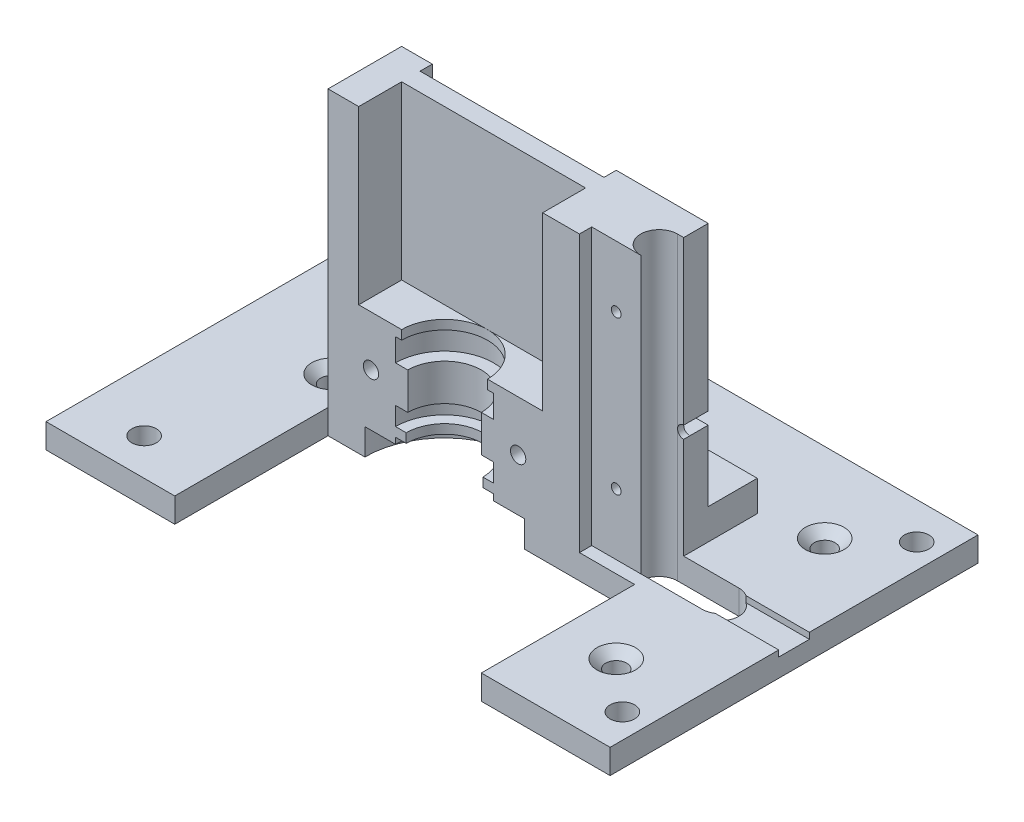
from build123d import *

# Parameters (mm, degrees)
BOSS_EXTRUDE1_DEPTH                          = 4
SKETCH2_W                                    = 50
SKETCH2_H                                    = 20
BOSS_EXTRUDE2_DEPTH                          = 5
SKETCH3_W                                    = 50
SKETCH3_H                                    = 12
BOSS_EXTRUDE3_DEPTH                          = 40
CUT_EXTRUDE1_DEPTH                           = 2
SKETCH5_W                                    = 30
SKETCH5_H                                    = 28
CUT_EXTRUDE2_DEPTH                           = 7
CUT_EXTRUDE3_DEPTH                           = 55
SKETCH8_W                                    = 9
SKETCH8_H                                    = 45
CUT_EXTRUDE4_DEPTH                           = 2
SKETCH9_W                                    = 50
SKETCH9_H                                    = 2
CUT_EXTRUDE5_DEPTH                           = 3
SKETCH10_R                                   = 1
CUT_EXTRUDE6_DEPTH                           = 2
SKETCH11_W                                   = 15
SKETCH11_H                                   = 5
CUT_EXTRUDE7_DEPTH                           = 1
SKETCH12_W                                   = 28.5
SKETCH12_H                                   = 8.5
BOSS_EXTRUDE4_DEPTH                          = 2
SKETCH13_W                                   = 27
SKETCH13_H                                   = 8
CUT_EXTRUDE8_DEPTH                           = 15
BOSS_EXTRUDE5_DEPTH                          = 27
SKETCH31_W                                   = 27
SKETCH31_H                                   = 0.75
CUT_EXTRUDE26_DEPTH                          = 4
M3_TAPPED_HOLE1_AT_2_COUNT                   = 2
M3_TAPPED_HOLE1_AT_2_PITCH                   = 24
SKETCH25_W                                   = 0.8
SKETCH25_H                                   = 33
M2_TAPPED_HOLE1_AT_2_COUNT                   = 2
M2_TAPPED_HOLE1_AT_2_PITCH                   = 25
SKETCH26_R                                   = 2
CUT_EXTRUDE25_DEPTH                          = 5
LPATTERN2_COUNT                              = 2
LPATTERN2_PITCH                              = 78
LPATTERN2_COUNT_DIR2                         = 2
LPATTERN2_PITCH_DIR2                         = 48
CSK_FOR_M3_COUNTERSUNK_FLAT_HEAD_SCR_2_COUNT = 2
CSK_FOR_M3_COUNTERSUNK_FLAT_HEAD_SCR_2_PITCH = 65.736215285
CSK_FOR_M3_COUNTERSUNK_FLAT_HEAD_SCR_3_COUNT = 2
CSK_FOR_M3_COUNTERSUNK_FLAT_HEAD_SCR_3_PITCH = 65.736215285
LPATTERN3_COUNT                              = 2
LPATTERN3_PITCH                              = 35
LPATTERN3_COUNT_DIR2                         = 2
LPATTERN3_PITCH_DIR2                         = 35
FILLET1_R                                    = 2
SKETCH32_R                                   = 13
CUT_EXTRUDE27_DEPTH                          = 4.3


with BuildPart() as part:
    # Sketch1 → Boss-Extrude1 (new body)
    with BuildSketch(Plane(origin=(0, 0, 0), x_dir=(1, 0, 0), z_dir=(0, 1, 0))):
        Polygon((25, -30), (46, -30), (46, 30), (-9.5, 30), (-9.5, 25), (-25, 25), (-25, 30), (-46, 30), (-46, -30), (-25, -30), (-25, -5), (25, -5), align=None)
    extrude(amount=BOSS_EXTRUDE1_DEPTH)

    # Sketch2 → Boss-Extrude2 (add)
    with BuildSketch(Plane(origin=(0, 4, 0), x_dir=(1, 0, 0), z_dir=(0, 1, 0))):
        with Locations((0, 5)):
            Rectangle(SKETCH2_W, SKETCH2_H)
    extrude(amount=BOSS_EXTRUDE2_DEPTH)

    # Sketch3 → Boss-Extrude3 (add)
    with BuildSketch(Plane(origin=(0, 9, 0), x_dir=(1, 0, 0), z_dir=(0, 1, 0))):
        with Locations((0, 1)):
            Rectangle(SKETCH3_W, SKETCH3_H)
    extrude(amount=BOSS_EXTRUDE3_DEPTH)

    # Sketch4 → Cut-Extrude1 (cut)
    with BuildSketch(Plane(origin=(0, 0, -7), x_dir=(-1, 0, 0), z_dir=(0, 0, -1))):
        Polygon((-10, 49), (20, 49), (20, 44), (25, 44), (25, 14), (20, 14), (20, 9), (-10, 9), (-10, 14), (-15, 14), (-15, 44), (-10, 44), align=None)
    extrude(amount=-CUT_EXTRUDE1_DEPTH, mode=Mode.SUBTRACT)

    # Sketch5 → Cut-Extrude2 (cut)
    with BuildSketch(Plane.XY.offset(5)):
        with Locations((-5, 35)):
            Rectangle(SKETCH5_W, SKETCH5_H)
    extrude(amount=-CUT_EXTRUDE2_DEPTH, mode=Mode.SUBTRACT)

    # Sketch6 → Cut-Revolve1 (revolve, cut)
    with BuildSketch(Plane.ZY.offset(6)):
        Polygon((5, 0), (5, 21), (-2, 21), (-2, 19.5), (-3, 19.5), (-3, 15.8), (-1, 15.8), (-1, 9.8), (-3, 9.8), (-3, 6.8), (-1.25, 6.8), (-1.25, 5.3), (-3, 5.3), (-3, 4.3), (-8, 4.3), (-8, 0), align=None)
    revolve(axis=Axis((-6, 0, 5), (0, 1, 0)), mode=Mode.SUBTRACT)

    # Sketch7 → Cut-Extrude3 (cut)
    with BuildSketch(Plane.XZ):
        with BuildLine():
            Line((34, -3), (24, -3))
            ThreePointArc((24, -3), (21, 0), (24, 3))
            Line((24, 3), (34, 3))
            ThreePointArc((34, 3), (37, 0), (34, -3))
        make_face()
    extrude(amount=-CUT_EXTRUDE3_DEPTH, mode=Mode.SUBTRACT)

    # Sketch8 → Cut-Extrude4 (cut)
    with BuildSketch(Plane.XY.offset(5)):
        with Locations((20.5, 26.5)):
            Rectangle(SKETCH8_W, SKETCH8_H)
    extrude(amount=-CUT_EXTRUDE4_DEPTH, mode=Mode.SUBTRACT)

    # Sketch9 → Cut-Extrude5 (cut)
    with BuildSketch(Plane(origin=(0, 0, -7), x_dir=(-1, 0, 0), z_dir=(0, 0, -1))):
        with Locations((0, 21.5)):
            Rectangle(SKETCH9_W, SKETCH9_H)
    extrude(amount=-CUT_EXTRUDE5_DEPTH, mode=Mode.SUBTRACT)

    # Sketch10 → Cut-Extrude6 (cut)
    with BuildSketch(Plane(origin=(0, 0, -4), x_dir=(-1, 0, 0), z_dir=(0, 0, -1))):
        with Locations((-25, 21.5)):
            Circle(SKETCH10_R)
    extrude(amount=-CUT_EXTRUDE6_DEPTH, mode=Mode.SUBTRACT)

    # Sketch11 → Cut-Extrude7 (cut)
    with BuildSketch(Plane(origin=(0, 4, 0), x_dir=(1, 0, 0), z_dir=(0, 1, 0))):
        with Locations((38.5, 0)):
            Rectangle(SKETCH11_W, SKETCH11_H)
    extrude(amount=-CUT_EXTRUDE7_DEPTH, mode=Mode.SUBTRACT)

    # Sketch12 → Boss-Extrude4 (add)
    with BuildSketch(Plane(origin=(0, 9, 0), x_dir=(1, 0, 0), z_dir=(0, 1, 0))):
        with Locations((-5, 10)):
            Rectangle(SKETCH12_W, SKETCH12_H)
    extrude(amount=BOSS_EXTRUDE4_DEPTH)

    # Sketch13 → Cut-Extrude8 (cut)
    with BuildSketch(Plane(origin=(0, 11, 0), x_dir=(1, 0, 0), z_dir=(0, 1, 0))):
        with Locations((-5.25, 9.75)):
            Rectangle(SKETCH13_W, SKETCH13_H)
    extrude(amount=-CUT_EXTRUDE8_DEPTH, mode=Mode.SUBTRACT)

    # Sketch18 → Boss-Extrude5 (add)
    with BuildSketch(Plane.ZY.offset(-8.25)):
        Polygon((-7, 4), (-7, 0), (-5.75, 0), (-5.75, 9), (-7.75, 5), (-7.75, 4), align=None)
    extrude(amount=BOSS_EXTRUDE5_DEPTH)

    # Sketch31 → Cut-Extrude26 (cut)
    with BuildSketch(Plane.XZ):
        with Locations((-5.25, -14.125)):
            Rectangle(SKETCH31_W, SKETCH31_H)
    extrude(amount=-CUT_EXTRUDE26_DEPTH, mode=Mode.SUBTRACT)

    # Sketch21 → Revolve2 (revolve)
    with BuildSketch(Plane.ZY.offset(-3)):
        with BuildLine():
            Line((-14.5, 3), (-14.5, 2))
            Line((-14.5, 2), (-13.5, 2))
            ThreePointArc((-13.5, 2), (-13.792893219, 2.707106781), (-14.5, 3))
        make_face()
        with BuildLine():
            Line((-7, 3), (-7, 2))
            Line((-7, 2), (-8, 2))
            ThreePointArc((-8, 2), (-7.707106781, 2.707106781), (-7, 3))
        make_face()
    revolve(axis=Axis((3, 2, -14.5), (0, 0, 1)))

    # Sketch23 → M3 Tapped Hole1 (revolve, cut)
    with BuildSketch(Plane(origin=(-18, 12.8, 5), x_dir=(0, -1, 0), z_dir=(1, 0, 0))):
        Polygon((0, 0), (0, 7.751075774), (1.25, 7), (1.25, 0), align=None)
    m3_tapped_hole1 = revolve(axis=Axis((-18, 12.8, 11.35), (0, 0, -1)), mode=Mode.SUBTRACT)

    # M3 Tapped Hole1 at 2: M3 Tapped Hole1 ×2
    with Locations(*[(i * M3_TAPPED_HOLE1_AT_2_PITCH, 0, 0) for i in range(1, M3_TAPPED_HOLE1_AT_2_COUNT)]):
        add(m3_tapped_hole1, mode=Mode.SUBTRACT)

    # Sketch25 → M2 Tapped Hole1 (revolve, cut)
    with BuildSketch(Plane(origin=(20, 39, 3), x_dir=(0, -1, 0), z_dir=(1, 0, 0))):
        with Locations((0.4, 16.5)):
            Rectangle(SKETCH25_W, SKETCH25_H)
    m2_tapped_hole1 = revolve(axis=Axis((20, 39, 9.35), (0, 0, -1)), mode=Mode.SUBTRACT)

    # M2 Tapped Hole1 at 2: M2 Tapped Hole1 ×2
    with Locations(*[(0, -i * M2_TAPPED_HOLE1_AT_2_PITCH, 0) for i in range(1, M2_TAPPED_HOLE1_AT_2_COUNT)]):
        add(m2_tapped_hole1, mode=Mode.SUBTRACT)

    # Sketch26 → Cut-Extrude25 (cut)
    with BuildSketch(Plane(origin=(0, 4, 0), x_dir=(1, 0, 0), z_dir=(0, 1, 0))):
        with Locations(Location((-36, 24, 0), (0, 0, 270))):
            Circle(SKETCH26_R)
    cut_extrude25 = extrude(amount=-CUT_EXTRUDE25_DEPTH, mode=Mode.SUBTRACT)

    # LPattern2: Cut-Extrude25 2 × 2
    with Locations(*[(i * LPATTERN2_PITCH, 0, j * LPATTERN2_PITCH_DIR2) for i in range(LPATTERN2_COUNT) for j in range(LPATTERN2_COUNT_DIR2) if (i, j) != (0, 0)]):
        add(cut_extrude25, mode=Mode.SUBTRACT)

    # Sketch28 → CSK for M3 Countersunk Flat Head Screw1 (revolve, cut)
    with BuildSketch(Plane(origin=(-29.5, 4, 0), x_dir=(0, 0, 1), z_dir=(1, 0, 0))):
        Polygon((0, 0), (0, 4), (1.7, 4), (1.7, 1.45), (3.15, 0), align=None)
    csk_for_m3_countersunk_flat_head_screw1 = revolve(axis=Axis((-29.5, 10.35, 0), (0, -1, 0)), mode=Mode.SUBTRACT)

    # CSK for M3 Countersunk Flat Head Scr 2: CSK for M3 Countersunk Flat Head Screw1 ×2
    with Locations(*[Vector(0.9659819891465423, 0, -0.25860935142505853) * (i * CSK_FOR_M3_COUNTERSUNK_FLAT_HEAD_SCR_2_PITCH) for i in range(1, CSK_FOR_M3_COUNTERSUNK_FLAT_HEAD_SCR_2_COUNT)]):
        add(csk_for_m3_countersunk_flat_head_screw1, mode=Mode.SUBTRACT)

    # CSK for M3 Countersunk Flat Head Scr 3: CSK for M3 Countersunk Flat Head Screw1 ×2
    with Locations(*[Vector(0.9659819891465423, 0, 0.25860935142505864) * (i * CSK_FOR_M3_COUNTERSUNK_FLAT_HEAD_SCR_3_PITCH) for i in range(1, CSK_FOR_M3_COUNTERSUNK_FLAT_HEAD_SCR_3_COUNT)]):
        add(csk_for_m3_countersunk_flat_head_screw1, mode=Mode.SUBTRACT)

    # Sketch30 → M2 Tapped Hole2 (revolve, cut)
    with BuildSketch(Plane(origin=(-22.5, 46.5, -7), x_dir=(0, 1, 0), z_dir=(1, 0, 0))):
        Polygon((0, 0), (0, 10.480688495), (0.8, 10), (0.8, 9.5), (1, 9.5), (1, 0.025), (1.025, 0), align=None)
    m2_tapped_hole2 = revolve(axis=Axis((-22.5, 46.5, -13.35), (0, 0, 1)), mode=Mode.SUBTRACT)

    # LPattern3: M2 Tapped Hole2 2 × 2
    with Locations(*[(i * LPATTERN3_PITCH, -j * LPATTERN3_PITCH_DIR2, 0) for i in range(LPATTERN3_COUNT) for j in range(LPATTERN3_COUNT_DIR2) if (i, j) != (0, 0)]):
        add(m2_tapped_hole2, mode=Mode.SUBTRACT)

    # Fillet1
    fillet1_edges = [part.edges().sort_by_distance(p)[0] for p in [
        (10, 44, -6),
        (-20, 44, -6),
        (-20, 14, -6),
        (10, 14, -6),
    ]]
    fillet(fillet1_edges, radius=FILLET1_R)

    # Sketch32 → Cut-Extrude27 (cut)
    with BuildSketch(Plane.XZ):
        with Locations((-6, 5)):
            Circle(SKETCH32_R)
    extrude(amount=-CUT_EXTRUDE27_DEPTH, mode=Mode.SUBTRACT)


with BuildPart() as body_2:
    # Sketch20 → Revolve1 (revolve)
    with BuildSketch(Plane.ZY.offset(15)):
        with BuildLine():
            Line((-14.5, 3), (-14.5, 2))
            Line((-14.5, 2), (-13.5, 2))
            ThreePointArc((-13.5, 2), (-13.792893219, 2.707106781), (-14.5, 3))
        make_face()
        with BuildLine():
            Line((-7, 3), (-7, 2))
            Line((-7, 2), (-8, 2))
            ThreePointArc((-8, 2), (-7.707106781, 2.707106781), (-7, 3))
        make_face()
    revolve(axis=Axis((-15, 2, -7), (0, 0, -1)))


solid = Compound([part.part, body_2.part])
